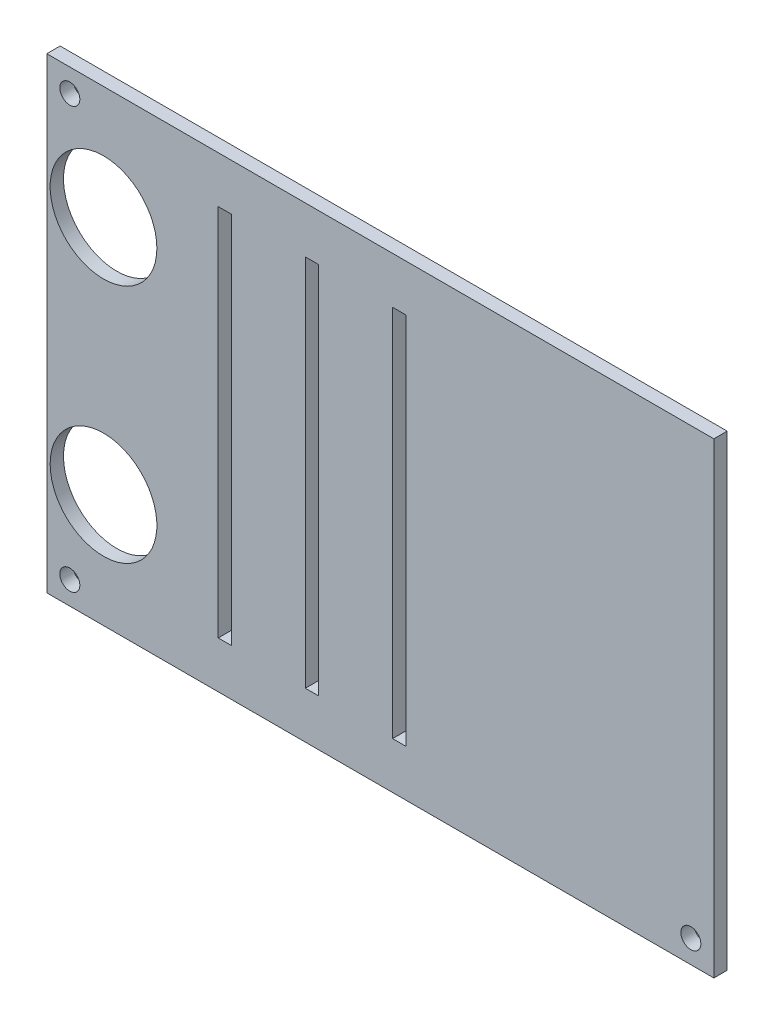
from build123d import *

# Parameters (mm, degrees)
SKETCH_1_W      = 100
SKETCH_1_H      = 70
SKETCH_1_R      = 1.5
SKETCH_1_R_2    = 8
SKETCH_1_W_2    = 2
SKETCH_1_H_2    = 56
EXTRUDE_1_DEPTH = 2


with BuildPart() as part:
    # ｽｹｯﾁ1 → ﾎﾞｽ - 押し出し1 (new body)
    with BuildSketch(Plane.XY):
        with Locations((50, -35)):
            Rectangle(SKETCH_1_W, SKETCH_1_H)
        with Locations((3.45, -3.45)):
            Circle(SKETCH_1_R, mode=Mode.SUBTRACT)
        with Locations(Location((3.45, -66.55, 0), (0, 0, 180))):
            Circle(SKETCH_1_R, mode=Mode.SUBTRACT)
        with Locations((96.55, -66.55)):
            Circle(SKETCH_1_R, mode=Mode.SUBTRACT)
        with Locations((8.5, -17)):
            Circle(SKETCH_1_R_2, mode=Mode.SUBTRACT)
        with Locations(Location((8.5, -53, 0), (0, 0, 180))):
            Circle(SKETCH_1_R_2, mode=Mode.SUBTRACT)
        with Locations((52.84, -35)):
            Rectangle(SKETCH_1_W_2, SKETCH_1_H_2, mode=Mode.SUBTRACT)
        with Locations((39.76, -35)):
            Rectangle(SKETCH_1_W_2, SKETCH_1_H_2, mode=Mode.SUBTRACT)
        with Locations((26.7, -35)):
            Rectangle(SKETCH_1_W_2, SKETCH_1_H_2, mode=Mode.SUBTRACT)
    extrude(amount=EXTRUDE_1_DEPTH)


solid = part.part
